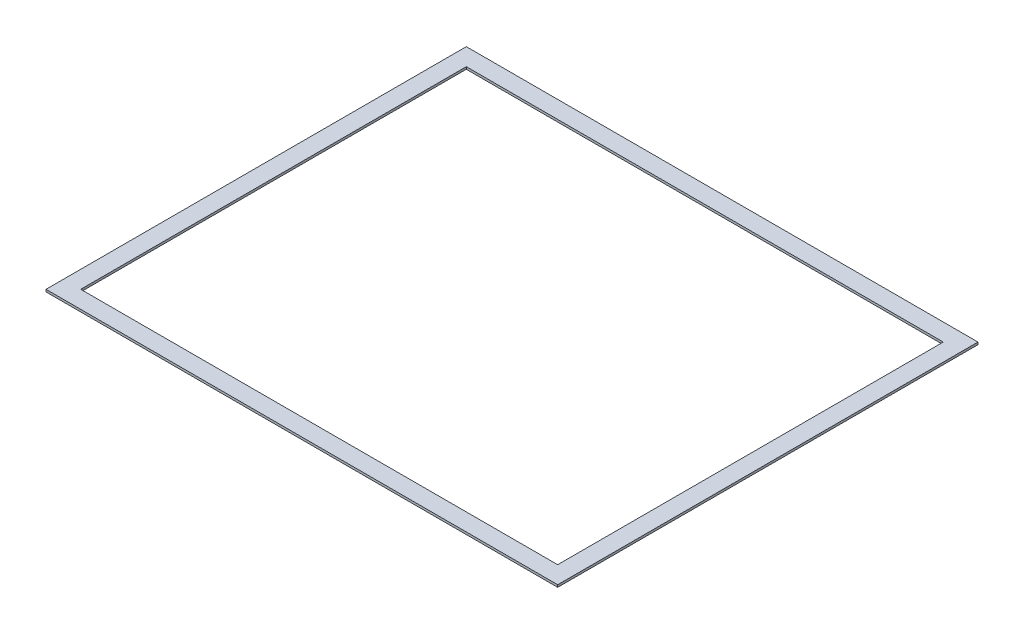
from build123d import *

# Parameters (mm, degrees)
SKETCH1_W           = 280
SKETCH1_H           = 230
BOSS_EXTRUDE1_DEPTH = 1.25
SKETCH2_W           = 261
SKETCH2_H           = 211
CUT_EXTRUDE1_DEPTH  = 363.355574678


with BuildPart() as part:
    # Sketch1 → Boss-Extrude1 (new body)
    with BuildSketch(Plane(origin=(0, 0, 0), x_dir=(1, 0, 0), z_dir=(0, 1, 0))):
        with Locations((-140, 115)):
            Rectangle(SKETCH1_W, SKETCH1_H)
    extrude(amount=BOSS_EXTRUDE1_DEPTH)

    # Sketch2 → Cut-Extrude1 (cut, through all)
    with BuildSketch(Plane(origin=(0, 1.25, 0), x_dir=(1, 0, 0), z_dir=(0, 1, 0))):
        with Locations((-140, 115)):
            Rectangle(SKETCH2_W, SKETCH2_H)
    extrude(amount=-CUT_EXTRUDE1_DEPTH, mode=Mode.SUBTRACT)


solid = part.part
